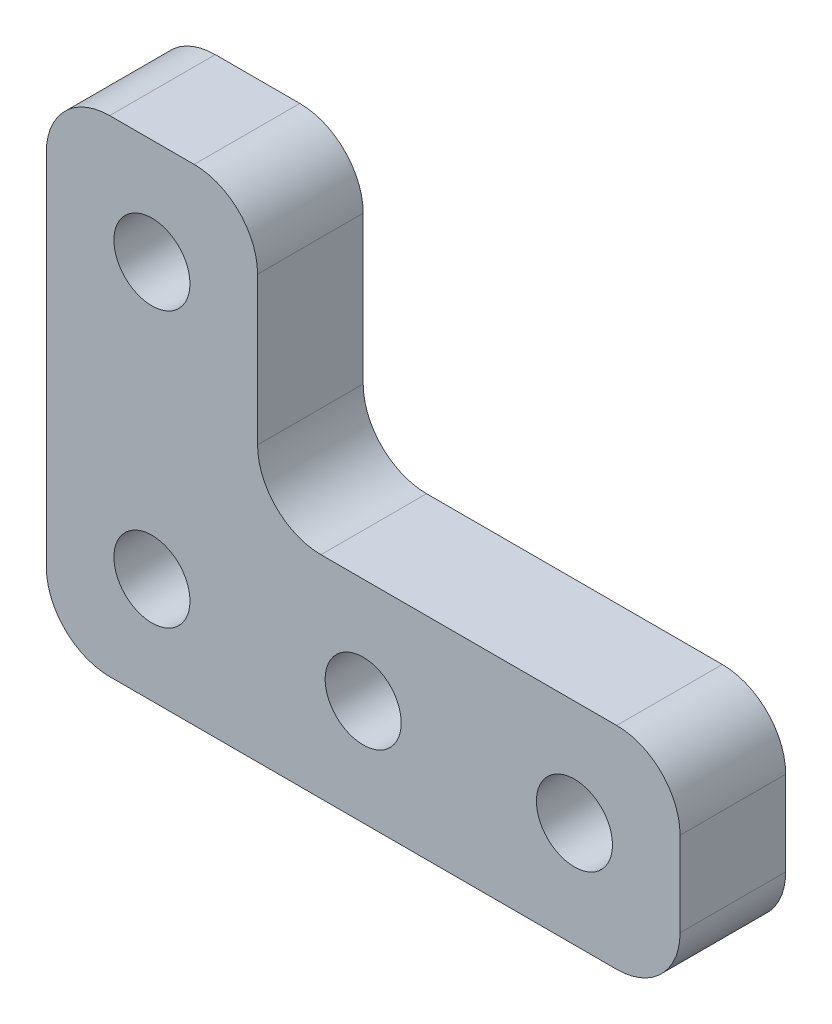
from build123d import *

# Parameters (mm, degrees)
SKETCH1_R           = 2.286
BOSS_EXTRUDE1_DEPTH = 6.35
FILLET1_R           = 3.81


with BuildPart() as part:
    # Sketch1 → Boss-Extrude1 (new body)
    with BuildSketch(Plane.XY):
        Polygon((-6.35, -6.35), (-6.35, 22.86), (6.35, 22.86), (6.35, 6.35), (31.75, 6.35), (31.75, -6.35), align=None)
        Circle(SKETCH1_R, mode=Mode.SUBTRACT)
        with Locations((12.7, 0)):
            Circle(SKETCH1_R, mode=Mode.SUBTRACT)
        with Locations((25.4, 0)):
            Circle(SKETCH1_R, mode=Mode.SUBTRACT)
        with Locations((0, 16.51)):
            Circle(SKETCH1_R, mode=Mode.SUBTRACT)
    extrude(amount=BOSS_EXTRUDE1_DEPTH)

    # Fillet1
    fillet1_edges = [part.edges().sort_by_distance(p)[0] for p in [
        (-6.35, -6.35, 3.175),
        (-6.35, 22.86, 3.175),
        (6.35, 22.86, 3.175),
        (6.35, 6.35, 3.175),
        (31.75, 6.35, 3.175),
        (31.75, -6.35, 3.175),
    ]]
    fillet(fillet1_edges, radius=FILLET1_R)


solid = part.part
